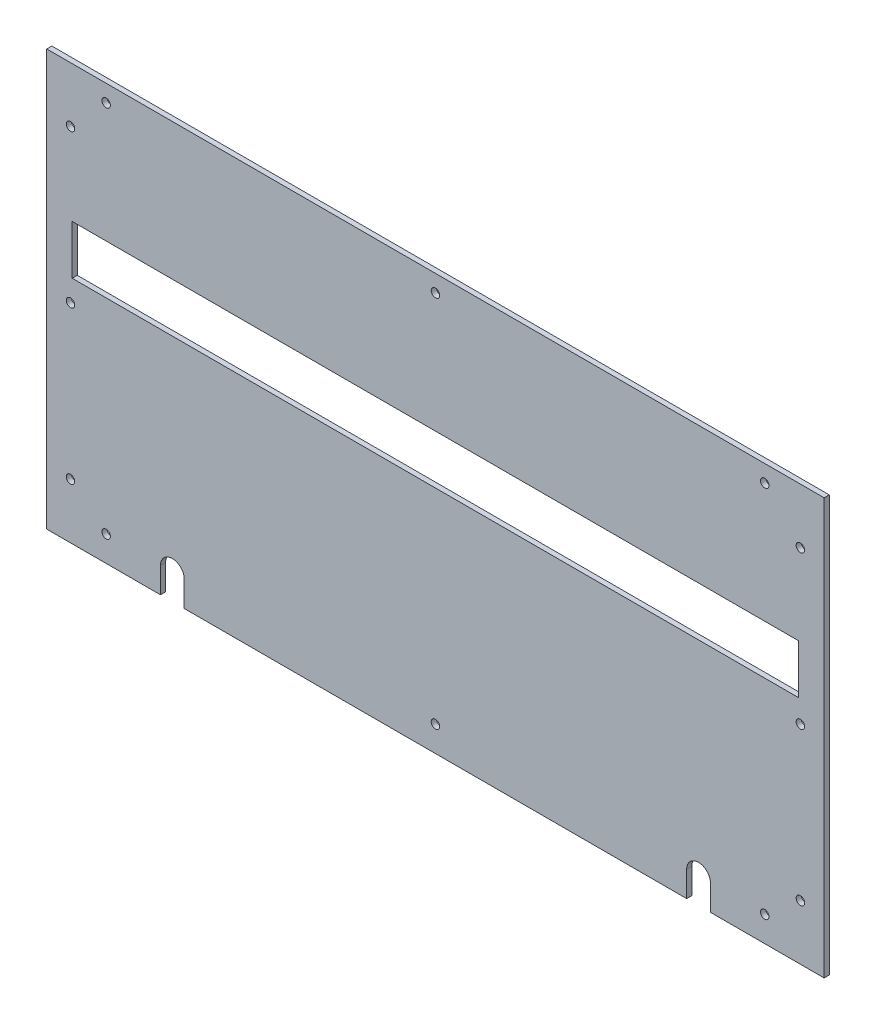
from build123d import *

# Parameters (mm, degrees)
SKETCH1_W           = 458
SKETCH1_H           = 245
BOSS_EXTRUDE1_DEPTH = 3
CUT_EXTRUDE1_DEPTH  = 260.723410574
SKETCH3_R           = 2.5
CUT_EXTRUDE2_DEPTH  = 260.723410574
SKETCH4_W           = 428
SKETCH4_H           = 29
CUT_EXTRUDE3_DEPTH  = 260.723410574


with BuildPart() as part:
    # Sketch1 → Boss-Extrude1 (new body)
    with BuildSketch(Plane.XY):
        Rectangle(SKETCH1_W, SKETCH1_H)
    extrude(amount=BOSS_EXTRUDE1_DEPTH)

    # Sketch2 → Cut-Extrude1 (cut, through all)
    with BuildSketch(Plane.XY.offset(3)):
        with BuildLine():
            Line((-148, -107.5), (-148, -122.5))
            ThreePointArc((-148, -122.5), (-155, -129.5), (-162, -122.5))
            Line((-162, -122.5), (-162, -107.5))
            ThreePointArc((-162, -107.5), (-155, -100.5), (-148, -107.5))
        make_face()
        with BuildLine():
            Line((162, -107.5), (162, -122.5))
            ThreePointArc((162, -122.5), (155, -129.5), (148, -122.5))
            Line((148, -122.5), (148, -107.5))
            ThreePointArc((148, -107.5), (155, -100.5), (162, -107.5))
        make_face()
    extrude(amount=-CUT_EXTRUDE1_DEPTH, mode=Mode.SUBTRACT)

    # Sketch3 → Cut-Extrude2 (cut, through all)
    with BuildSketch(Plane.XY.offset(3)):
        with Locations((-194, 112.5)):
            Circle(SKETCH3_R)
        with Locations((-194, -107.5)):
            Circle(SKETCH3_R)
        with Locations((194, -107.5)):
            Circle(SKETCH3_R)
        with Locations((194, 112.5)):
            Circle(SKETCH3_R)
        with Locations((-215, 0)):
            Circle(SKETCH3_R)
        with Locations((-215, -90)):
            Circle(SKETCH3_R)
        with Locations((-215, 90)):
            Circle(SKETCH3_R)
        with Locations((215, 0)):
            Circle(SKETCH3_R)
        with Locations((215, -90)):
            Circle(SKETCH3_R)
        with Locations((215, 90)):
            Circle(SKETCH3_R)
        with Locations((0, 112.5)):
            Circle(SKETCH3_R)
        with Locations((0, -107.5)):
            Circle(SKETCH3_R)
    extrude(amount=-CUT_EXTRUDE2_DEPTH, mode=Mode.SUBTRACT)

    # Sketch4 → Cut-Extrude3 (cut, through all)
    with BuildSketch(Plane.XY.offset(3)):
        with Locations((0, 27.5)):
            Rectangle(SKETCH4_W, SKETCH4_H)
    extrude(amount=-CUT_EXTRUDE3_DEPTH, mode=Mode.SUBTRACT)


solid = part.part
